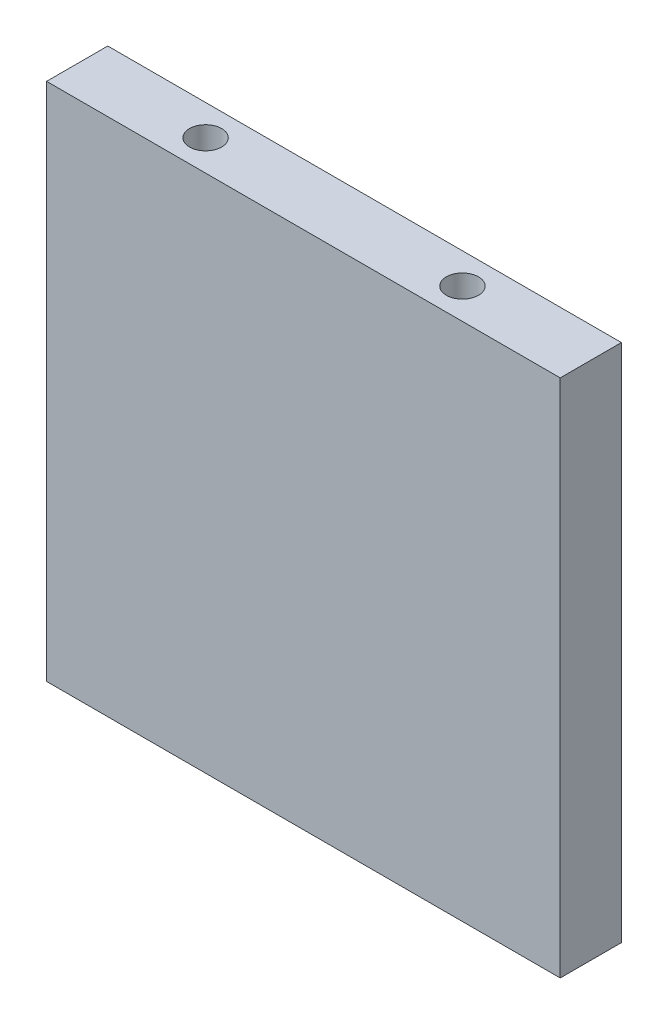
from build123d import *

# Parameters (mm, degrees)
ESBO_O1_W                = 80
ESBO_O1_H                = 80.95
RESSALTO_EXTRUS_O1_DEPTH = 9.53
ESBO_O2_R                = 2.5
CORTE_EXTRUS_O1_DEPTH    = 20
CORTE_EXTRUS_O2_START    = -20
ESBO_O3_R                = 2.5
CORTE_EXTRUS_O2_DEPTH    = 20


with BuildPart() as part:
    # Esboço1 → Ressalto-extrusão1 (new body)
    with BuildSketch(Plane.XY):
        Rectangle(ESBO_O1_W, ESBO_O1_H)
    extrude(amount=RESSALTO_EXTRUS_O1_DEPTH)

    # Esboço2 → Corte-extrusão1 (cut)
    with BuildSketch(Plane(origin=(0, 40.475, 0), x_dir=(1, 0, 0), z_dir=(0, 1, 0))):
        with Locations(Location((-20, -4.7625, 0), (0, 0, 270))):
            Circle(ESBO_O2_R)
        with Locations(Location((20, -4.7625, 0), (0, 0, 90))):
            Circle(ESBO_O2_R)
    extrude(amount=-CORTE_EXTRUS_O1_DEPTH, mode=Mode.SUBTRACT)

    # Esboço3 → Corte-extrusão2 (cut)
    with BuildSketch(Plane.XZ.offset(40.475).offset(CORTE_EXTRUS_O2_START)):
        with Locations(Location((-20, 4.7625, 0), (0, 0, 90))):
            Circle(ESBO_O3_R)
        with Locations(Location((20, 5, 0), (0, 0, 90))):
            Circle(ESBO_O3_R)
    extrude(amount=CORTE_EXTRUS_O2_DEPTH, mode=Mode.SUBTRACT)


solid = part.part
